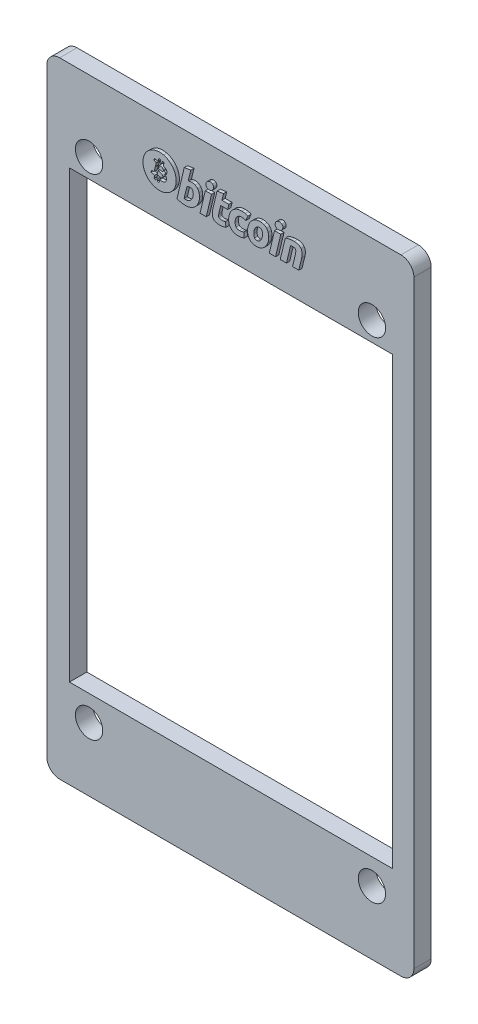
from build123d import *

# Parameters (mm, degrees)
ESQUISSE1_W             = 57
ESQUISSE1_H             = 97
BOSS_EXTRU_1_DEPTH      = 2.7
CONG_1_R                = 2
ESQUISSE2_W             = 50.132000889
ESQUISSE2_H             = 69.148527899
ENL_V_MAT_EXTRU_1_DEPTH = 4
ESQUISSE3_R             = 2.123955659
ENL_V_MAT_EXTRU_2_DEPTH = 4
BOSS_EXTRU_2_DEPTH      = 0.5


with BuildPart() as part:
    # Esquisse1 → Boss.-Extru.1 (new body)
    with BuildSketch(Plane.XY):
        with Locations((-2.5, -2.5)):
            Rectangle(ESQUISSE1_W, ESQUISSE1_H)
    extrude(amount=BOSS_EXTRU_1_DEPTH)

    # Congé1
    cong_1_edges = [part.edges().sort_by_distance(p)[0] for p in [
        (26, -51, 1.35),
        (-31, -51, 1.35),
        (-31, 46, 1.35),
        (26, 46, 1.35),
    ]]
    fillet(cong_1_edges, radius=CONG_1_R)

    # Esquisse2 → Enlèv. mat.-Extru.1 (cut)
    with BuildSketch(Plane.XY.offset(2.7)):
        with Locations((-2.412492696, -2.609286254)):
            Rectangle(ESQUISSE2_W, ESQUISSE2_H)
    extrude(amount=-ENL_V_MAT_EXTRU_1_DEPTH, mode=Mode.SUBTRACT)

    # Esquisse3 → Enlèv. mat.-Extru.2 (cut)
    with BuildSketch(Plane.XY.offset(2.7)):
        with Locations((-24.430072288, 34.959505651)):
            Circle(ESQUISSE3_R)
        with Locations((19.486527712, 34.959505651)):
            Circle(ESQUISSE3_R)
        with Locations((19.486527712, -41.138894349)):
            Circle(ESQUISSE3_R)
        with Locations((-24.430072288, -41.138894349)):
            Circle(ESQUISSE3_R)
    extrude(amount=-ENL_V_MAT_EXTRU_2_DEPTH, mode=Mode.SUBTRACT)

    # Esquisse4 → Boss.-Extru.2 (add)
    # profile 1 of 12: a face of its own
    with BuildSketch(Plane(origin=(-2.391362005, 35.741640935, 2.7), x_dir=(1, 0, 0), z_dir=(0, 0, 1))):
        with BuildLine():
            add(Edge.make_bspline(
                [(-9.965735834, 5.758576363), (-8.583076166, 5.413897855), (-7.741867028, 4.013418817), (-8.08646324, 2.630921455)],
                knots=[0, 0, 0, 0, 1, 1, 1, 1], degree=3))
            add(Edge.make_bspline(
                [(-8.08646324, 2.630921455), (-8.431141748, 1.248261787), (-9.831460766, 0.407054935), (-11.214038138, 0.751651147)],
                knots=[0, 0, 0, 0, 1, 1, 1, 1], degree=3))
            add(Edge.make_bspline(
                [(-11.214038138, 0.751651147), (-12.596133164, 1.096407379), (-13.437582332, 2.496726397), (-13.092663794, 3.879143749)],
                knots=[0, 0, 0, 0, 1, 1, 1, 1], degree=3))
            add(Edge.make_bspline(
                [(-13.092663794, 3.879143749), (-12.748229888, 5.261883427), (-11.347908584, 6.103252585), (-9.965735834, 5.758576363)],
                knots=[0, 0, 0, 0, 1, 1, 1, 1], degree=3))
        make_face()
        with BuildLine():
            add(Edge.make_bspline(
                [(-9.813332786, 3.206952307), (-9.628331378, 3.249693649), (-9.488976818, 3.371386573), (-9.4517996, 3.622757419)],
                knots=[0, 0, 0, 0, 1, 1, 1, 1], degree=3))
            add(Edge.make_bspline(
                [(-9.4517996, 3.622757419), (-9.400428608, 3.966144337), (-9.661880714, 4.150741123), (-10.019461406, 4.273885657)],
                knots=[0, 0, 0, 0, 1, 1, 1, 1], degree=3))
            Line((-10.019461406, 4.273885657), (-9.903412616, 4.739045509))
            Line((-9.903412616, 4.739045509), (-10.186556576, 4.809609757))
            Line((-10.186556576, 4.809609757), (-10.29945983, 4.356707437))
            add(Edge.make_bspline(
                [(-10.29945983, 4.356707437), (-10.373894276, 4.375256041), (-10.45034726, 4.392755371), (-10.526233316, 4.410094681)],
                knots=[0, 0, 0, 0, 1, 1, 1, 1], degree=3))
            Line((-10.526233316, 4.410094681), (-10.4126054, 4.865980231))
            Line((-10.4126054, 4.865980231), (-10.695507044, 4.936544479))
            Line((-10.695507044, 4.936544479), (-10.811555834, 4.471546933))
            add(Edge.make_bspline(
                [(-10.811555834, 4.471546933), (-10.873168106, 4.485578401), (-10.933651094, 4.499449849), (-10.992362432, 4.514045959)],
                knots=[0, 0, 0, 0, 1, 1, 1, 1], degree=3))
            Line((-10.992362432, 4.514045959), (-10.992040106, 4.515497569))
            Line((-10.992040106, 4.515497569), (-11.382523196, 4.612997755))
            Line((-11.382523196, 4.612997755), (-11.45784461, 4.310578243))
            add(Edge.make_bspline(
                [(-11.45784461, 4.310578243), (-11.247763496, 4.262432797), (-11.252280632, 4.259449567)],
                knots=[0, 0, 0, 1, 1, 1], degree=2))
            add(Edge.make_bspline(
                [(-11.252280632, 4.259449567), (-11.137523432, 4.230819703), (-11.11679627, 4.154933647), (-11.120264132, 4.094772985)],
                knots=[0, 0, 0, 0, 1, 1, 1, 1], degree=3))
            Line((-11.120264132, 4.094772985), (-11.252442938, 3.564855325))
            add(Edge.make_bspline(
                [(-11.252442938, 3.564855325), (-11.24445794, 3.562839073), (-11.23421666, 3.559853557), (-11.222926106, 3.555418717)],
                knots=[0, 0, 0, 0, 1, 1, 1, 1], degree=3))
            add(Edge.make_bspline(
                [(-11.222926106, 3.555418717), (-11.232442724, 3.557757295), (-11.242521698, 3.560338189), (-11.252845274, 3.562839073)],
                knots=[0, 0, 0, 0, 1, 1, 1, 1], degree=3))
            Line((-11.252845274, 3.562839073), (-11.438006702, 2.820501721))
            add(Edge.make_bspline(
                [(-11.438006702, 2.820501721), (-11.45203817, 2.785663081), (-11.487683768, 2.733485131), (-11.567764634, 2.753243029)],
                knots=[0, 0, 0, 0, 1, 1, 1, 1], degree=3))
            add(Edge.make_bspline(
                [(-11.567764634, 2.753243029), (-11.565021434, 2.749130515), (-11.773570928, 2.804614021)],
                knots=[0, 0, 0, 1, 1, 1], degree=2))
            Line((-11.773570928, 2.804614021), (-11.914214792, 2.480420359))
            Line((-11.914214792, 2.480420359), (-11.545668158, 2.388486583))
            add(Edge.make_bspline(
                [(-11.545668158, 2.388486583), (-11.477200172, 2.371307293), (-11.41002149, 2.353405627), (-11.343812072, 2.336468653)],
                knots=[0, 0, 0, 0, 1, 1, 1, 1], degree=3))
            Line((-11.343812072, 2.336468653), (-11.461070156, 1.865986993))
            Line((-11.461070156, 1.865986993), (-11.178248522, 1.795422745))
            Line((-11.178248522, 1.795422745), (-11.062199732, 2.260984933))
            add(Edge.make_bspline(
                [(-11.062199732, 2.260984933), (-10.984942076, 2.240017741), (-10.910022998, 2.220664465), (-10.83655553, 2.202355891)],
                knots=[0, 0, 0, 0, 1, 1, 1, 1], degree=3))
            Line((-10.83655553, 2.202355891), (-10.952199698, 1.739132281))
            Line((-10.952199698, 1.739132281), (-10.669055738, 1.668568033))
            Line((-10.669055738, 1.668568033), (-10.551877664, 2.138082715))
            add(Edge.make_bspline(
                [(-10.551877664, 2.138082715), (-10.069138472, 2.046711295), (-9.705993656, 2.083566187), (-9.553169984, 2.520178471)],
                knots=[0, 0, 0, 0, 1, 1, 1, 1], degree=3))
            add(Edge.make_bspline(
                [(-9.553169984, 2.520178471), (-9.43002545, 2.871790417), (-9.559301036, 3.074613481), (-9.813332786, 3.206952307)],
                knots=[0, 0, 0, 0, 1, 1, 1, 1], degree=3))
        make_face(mode=Mode.SUBTRACT)
    # profile 2 of 12: a face of its own
    with BuildSketch(Plane(origin=(-2.391362005, 35.741640935, 2.7), x_dir=(1, 0, 0), z_dir=(0, 0, 1))):
        with BuildLine():
            add(Edge.make_bspline(
                [(-10.602604004, 4.075659739), (-10.442846894, 4.035821617), (-9.928009976, 3.961467181), (-10.011154082, 3.627836911)],
                knots=[0, 0, 0, 0, 1, 1, 1, 1], degree=3))
            add(Edge.make_bspline(
                [(-10.011154082, 3.627836911), (-10.090992632, 3.308000365), (-10.583813084, 3.470500675), (-10.74357248, 3.510338797)],
                knots=[0, 0, 0, 0, 1, 1, 1, 1], degree=3))
            Line((-10.74357248, 3.510338797), (-10.602604004, 4.075659739))
        make_face()
    # profile 3 of 12: a face of its own
    with BuildSketch(Plane(origin=(-2.391362005, 35.741640935, 2.7), x_dir=(1, 0, 0), z_dir=(0, 0, 1))):
        with BuildLine():
            add(Edge.make_bspline(
                [(-10.81470137, 3.225096289), (-10.622766524, 3.177193159), (-10.007283884, 3.082273867), (-10.098735314, 2.715663475)],
                knots=[0, 0, 0, 0, 1, 1, 1, 1], degree=3))
            add(Edge.make_bspline(
                [(-10.098735314, 2.715663475), (-10.18623425, 2.364131539), (-10.778248814, 2.554050133), (-10.970265956, 2.601790957)],
                knots=[0, 0, 0, 0, 1, 1, 1, 1], degree=3))
            Line((-10.970265956, 2.601790957), (-10.81470137, 3.225096289))
        make_face()
    # profile 4 of 12: a face of its own
    with BuildSketch(Plane(origin=(-2.391362005, 35.741640935, 2.7), x_dir=(1, 0, 0), z_dir=(0, 0, 1))):
        with BuildLine():
            add(Edge.make_bspline(
                [(-5.888170202, 4.241474749), (-5.800993592, 4.263086593), (-5.7074459, 4.274377147), (-5.60752484, 4.274377147)],
                knots=[0, 0, 0, 0, 1, 1, 1, 1], degree=3))
            add(Edge.make_bspline(
                [(-5.60752484, 4.274377147), (-5.398170674, 4.274377147), (-5.217446372, 4.236877603), (-5.065429658, 4.163247829)],
                knots=[0, 0, 0, 0, 1, 1, 1, 1], degree=3))
            add(Edge.make_bspline(
                [(-5.065429658, 4.163247829), (-4.912768292, 4.088893393), (-4.786800548, 3.988732303), (-4.68575249, 3.862764559)],
                knots=[0, 0, 0, 0, 1, 1, 1, 1], degree=3))
            add(Edge.make_bspline(
                [(-4.68575249, 3.862764559), (-4.586156042, 3.736152163), (-4.511963912, 3.588167953), (-4.463978486, 3.418571899)],
                knots=[0, 0, 0, 0, 1, 1, 1, 1], degree=3))
            add(Edge.make_bspline(
                [(-4.463978486, 3.418571899), (-4.416399968, 3.248491213), (-4.39252727, 3.065670649), (-4.39252727, 2.870025625)],
                knots=[0, 0, 0, 0, 1, 1, 1, 1], degree=3))
            add(Edge.make_bspline(
                [(-4.39252727, 2.870025625), (-4.39252727, 2.569300039), (-4.44760844, 2.285349121), (-4.558897778, 2.017608229)],
                knots=[0, 0, 0, 0, 1, 1, 1, 1], degree=3))
            add(Edge.make_bspline(
                [(-4.558897778, 2.017608229), (-4.670107106, 1.749462715), (-4.820994536, 1.516882789), (-5.012929382, 1.318414555)],
                knots=[0, 0, 0, 0, 1, 1, 1, 1], degree=3))
            add(Edge.make_bspline(
                [(-5.012929382, 1.318414555), (-5.204704208, 1.120270933), (-5.431075358, 0.964141705), (-5.692202852, 0.848657557)],
                knots=[0, 0, 0, 0, 1, 1, 1, 1], degree=3))
            add(Edge.make_bspline(
                [(-5.692202852, 0.848657557), (-5.95292801, 0.733255705), (-6.236394296, 0.675513631), (-6.54075005, 0.675513631)],
                knots=[0, 0, 0, 0, 1, 1, 1, 1], degree=3))
            add(Edge.make_bspline(
                [(-6.54075005, 0.675513631), (-6.58010354, 0.675513631), (-6.649378484, 0.676642915), (-6.74703869, 0.678659167)],
                knots=[0, 0, 0, 0, 1, 1, 1, 1], degree=3))
            add(Edge.make_bspline(
                [(-6.74703869, 0.678659167), (-6.844781192, 0.680593123), (-6.957119804, 0.690674383), (-7.083007538, 0.707691367)],
                knots=[0, 0, 0, 0, 1, 1, 1, 1], degree=3))
            add(Edge.make_bspline(
                [(-7.083007538, 0.707691367), (-7.209537638, 0.725350717), (-7.34341037, 0.751479697), (-7.484778896, 0.786560653)],
                knots=[0, 0, 0, 0, 1, 1, 1, 1], degree=3))
            add(Edge.make_bspline(
                [(-7.484778896, 0.786560653), (-7.626069698, 0.820916947), (-7.76026247, 0.868980097), (-7.886634836, 0.930110023)],
                knots=[0, 0, 0, 0, 1, 1, 1, 1], degree=3))
            Line((-7.886634836, 0.930110023), (-6.756717614, 5.678246323))
            Line((-6.756717614, 5.678246323), (-5.744623118, 5.835100213))
            Line((-5.744623118, 5.835100213), (-6.149137676, 4.150183339))
            add(Edge.make_bspline(
                [(-6.149137676, 4.150183339), (-6.062525708, 4.189216789), (-5.975266802, 4.219458283), (-5.888170202, 4.241474749)],
                knots=[0, 0, 0, 0, 1, 1, 1, 1], degree=3))
        make_face()
        with BuildLine():
            add(Edge.make_bspline(
                [(-6.573732458, 1.478496277), (-6.542846312, 1.478496277), (-6.504297494, 1.478413981), (-6.456394364, 1.478413981)],
                knots=[0, 0, 0, 0, 1, 1, 1, 1], degree=3))
            add(Edge.make_bspline(
                [(-6.456394364, 1.478413981), (-6.303975314, 1.478413981), (-6.16034822, 1.515915811), (-6.0254285, 1.589463289)],
                knots=[0, 0, 0, 0, 1, 1, 1, 1], degree=3))
            add(Edge.make_bspline(
                [(-6.0254285, 1.589463289), (-5.890186454, 1.663173073), (-5.773330706, 1.762689511), (-5.67551048, 1.886641003)],
                knots=[0, 0, 0, 0, 1, 1, 1, 1], degree=3))
            add(Edge.make_bspline(
                [(-5.67551048, 1.886641003), (-5.577687968, 2.011237147), (-5.500348016, 2.151478675), (-5.443815236, 2.308252555)],
                knots=[0, 0, 0, 0, 1, 1, 1, 1], degree=3))
            add(Edge.make_bspline(
                [(-5.443815236, 2.308252555), (-5.387364752, 2.464864129), (-5.358897194, 2.628331417), (-5.358897194, 2.798332093)],
                knots=[0, 0, 0, 0, 1, 1, 1, 1], degree=3))
            add(Edge.make_bspline(
                [(-5.358897194, 2.798332093), (-5.358897194, 3.007443943), (-5.393735834, 3.170266579), (-5.463413114, 3.288169315)],
                knots=[0, 0, 0, 0, 1, 1, 1, 1], degree=3))
            add(Edge.make_bspline(
                [(-5.463413114, 3.288169315), (-5.533010384, 3.405507409), (-5.661719042, 3.464541073), (-5.848734416, 3.464541073)],
                knots=[0, 0, 0, 0, 1, 1, 1, 1], degree=3))
            add(Edge.make_bspline(
                [(-5.848734416, 3.464541073), (-5.910106658, 3.464541073), (-5.988975944, 3.452845897), (-6.086878466, 3.431958715)],
                knots=[0, 0, 0, 0, 1, 1, 1, 1], degree=3))
            add(Edge.make_bspline(
                [(-6.086878466, 3.431958715), (-6.18518561, 3.409782229), (-6.273089168, 3.363733045), (-6.351798434, 3.294460387)],
                knots=[0, 0, 0, 0, 1, 1, 1, 1], degree=3))
            Line((-6.351798434, 3.294460387), (-6.782604278, 1.505107603))
            add(Edge.make_bspline(
                [(-6.782604278, 1.505107603), (-6.756717614, 1.500430447), (-6.733651874, 1.496155627), (-6.714056282, 1.492043113)],
                knots=[0, 0, 0, 0, 1, 1, 1, 1], degree=3))
            add(Edge.make_bspline(
                [(-6.714056282, 1.492043113), (-6.694863026, 1.487528263), (-6.673653518, 1.484382727), (-6.65260403, 1.482286465)],
                knots=[0, 0, 0, 0, 1, 1, 1, 1], degree=3))
            add(Edge.make_bspline(
                [(-6.65260403, 1.482286465), (-6.630185228, 1.479785581), (-6.60462089, 1.478496277), (-6.573732458, 1.478496277)],
                knots=[0, 0, 0, 0, 1, 1, 1, 1], degree=3))
        make_face(mode=Mode.SUBTRACT)
    # profile 5 of 12: a face of its own
    with BuildSketch(Plane(origin=(-2.391362005, 35.741640935, 2.7), x_dir=(1, 0, 0), z_dir=(0, 0, 1))):
        Polygon((-2.519991518, 4.201563475), (-3.342974378, 0.766327267), (-4.309584332, 0.766327267), (-3.49321487, 4.201563475), align=None)
    # profile 6 of 12: a face of its own
    with BuildSketch(Plane(origin=(-2.391362005, 35.741640935, 2.7), x_dir=(1, 0, 0), z_dir=(0, 0, 1))):
        with BuildLine():
            add(Edge.make_bspline(
                [(-2.614748504, 4.672125145), (-2.695636328, 4.636804159), (-2.781281318, 4.620109501), (-2.872570442, 4.620109501)],
                knots=[0, 0, 0, 0, 1, 1, 1, 1], degree=3))
            add(Edge.make_bspline(
                [(-2.872570442, 4.620109501), (-3.007490162, 4.620109501), (-3.129747728, 4.660272235), (-3.238376162, 4.740755437)],
                knots=[0, 0, 0, 0, 1, 1, 1, 1], degree=3))
            add(Edge.make_bspline(
                [(-3.238376162, 4.740755437), (-3.347811554, 4.820754007), (-3.401925746, 4.943900827), (-3.401925746, 5.109866713)],
                knots=[0, 0, 0, 0, 1, 1, 1, 1], degree=3))
            add(Edge.make_bspline(
                [(-3.401925746, 5.109866713), (-3.401925746, 5.201158123), (-3.383457152, 5.286803113), (-3.34668227, 5.367608641)],
                knots=[0, 0, 0, 0, 1, 1, 1, 1], degree=3))
            add(Edge.make_bspline(
                [(-3.34668227, 5.367608641), (-3.309345032, 5.448254149), (-3.260554934, 5.517689113), (-3.199425008, 5.576720491)],
                knots=[0, 0, 0, 0, 1, 1, 1, 1], degree=3))
            add(Edge.make_bspline(
                [(-3.199425008, 5.576720491), (-3.138377378, 5.635269523), (-3.067650824, 5.682043369), (-2.987329928, 5.717204335)],
                knots=[0, 0, 0, 0, 1, 1, 1, 1], degree=3))
            add(Edge.make_bspline(
                [(-2.987329928, 5.717204335), (-2.906522114, 5.751962965), (-2.820474788, 5.769382285), (-2.728943348, 5.769382285)],
                knots=[0, 0, 0, 0, 1, 1, 1, 1], degree=3))
            add(Edge.make_bspline(
                [(-2.728943348, 5.769382285), (-2.594103638, 5.769382285), (-2.472410714, 5.729221837), (-2.363459954, 5.648736349)],
                knots=[0, 0, 0, 0, 1, 1, 1, 1], degree=3))
            add(Edge.make_bspline(
                [(-2.363459954, 5.648736349), (-2.25491153, 5.567850811), (-2.200314992, 5.444706277), (-2.200314992, 5.279625073)],
                knots=[0, 0, 0, 0, 1, 1, 1, 1], degree=3))
            add(Edge.make_bspline(
                [(-2.200314992, 5.279625073), (-2.200314992, 5.188011337), (-2.2187813, 5.102044021), (-2.255878508, 5.021400799)],
                knots=[0, 0, 0, 0, 1, 1, 1, 1], degree=3))
            add(Edge.make_bspline(
                [(-2.255878508, 5.021400799), (-2.2927334, 4.940755291), (-2.341523498, 4.871320327), (-2.402653424, 4.812286663)],
                knots=[0, 0, 0, 0, 1, 1, 1, 1], degree=3))
            add(Edge.make_bspline(
                [(-2.402653424, 4.812286663), (-2.463216422, 4.753657621), (-2.534587628, 4.707046081), (-2.614748504, 4.672125145)],
                knots=[0, 0, 0, 0, 1, 1, 1, 1], degree=3))
        make_face()
    # profile 7 of 12: a face of its own
    with BuildSketch(Plane(origin=(-2.391362005, 35.741640935, 2.7), x_dir=(1, 0, 0), z_dir=(0, 0, 1))):
        with BuildLine():
            add(Edge.make_bspline(
                [(-2.404434218, 1.720099045), (-2.395564538, 1.920663541), (-2.365323044, 2.131711633), (-2.313065084, 2.353727953)],
                knots=[0, 0, 0, 0, 1, 1, 1, 1], degree=3))
            Line((-2.313065084, 2.353727953), (-1.672822778, 5.057432731))
            Line((-1.672822778, 5.057432731), (-0.660245936, 5.214286621))
            Line((-0.660245936, 5.214286621), (-0.908873582, 4.201707493))
            Line((-0.908873582, 4.201707493), (0.175399078, 4.201707493))
            Line((0.175399078, 4.201707493), (-0.020408252, 3.405095929))
            Line((-0.020408252, 3.405095929), (-1.098227534, 3.405095929))
            Line((-1.098227534, 3.405095929), (-1.385323988, 2.203405165))
            add(Edge.make_bspline(
                [(-1.385323988, 2.203405165), (-1.411775294, 2.103406381), (-1.426696016, 2.009856403), (-1.43096855, 1.922922109)],
                knots=[0, 0, 0, 0, 1, 1, 1, 1], degree=3))
            add(Edge.make_bspline(
                [(-1.43096855, 1.922922109), (-1.435728002, 1.835503183), (-1.424679764, 1.760504095), (-1.398550784, 1.697357917)],
                knots=[0, 0, 0, 0, 1, 1, 1, 1], degree=3))
            add(Edge.make_bspline(
                [(-1.398550784, 1.697357917), (-1.372501814, 1.634051719), (-1.325807978, 1.585181611), (-1.25806694, 1.550907613)],
                knots=[0, 0, 0, 0, 1, 1, 1, 1], degree=3))
            add(Edge.make_bspline(
                [(-1.25806694, 1.550907613), (-1.190648228, 1.515744361), (-1.09411502, 1.498085011), (-0.967582634, 1.498085011)],
                knots=[0, 0, 0, 0, 1, 1, 1, 1], degree=3))
            add(Edge.make_bspline(
                [(-0.967582634, 1.498085011), (-0.86330903, 1.498085011), (-0.76161632, 1.508003965), (-0.663389186, 1.527681853)],
                knots=[0, 0, 0, 0, 1, 1, 1, 1], degree=3))
            add(Edge.make_bspline(
                [(-0.663389186, 1.527681853), (-0.56572898, 1.546955119), (-0.46685948, 1.573891057), (-0.36669839, 1.609212043)],
                knots=[0, 0, 0, 0, 1, 1, 1, 1], degree=3))
            Line((-0.36669839, 1.609212043), (-0.294520226, 0.864376093))
            add(Edge.make_bspline(
                [(-0.294520226, 0.864376093), (-0.42500282, 0.816472963), (-0.566455928, 0.775263241), (-0.719034998, 0.740584621)],
                knots=[0, 0, 0, 0, 1, 1, 1, 1], degree=3))
            add(Edge.make_bspline(
                [(-0.719034998, 0.740584621), (-0.871616354, 0.705423655), (-1.052420666, 0.688568977), (-1.261212476, 0.688568977)],
                knots=[0, 0, 0, 0, 1, 1, 1, 1], degree=3))
            add(Edge.make_bspline(
                [(-1.261212476, 0.688568977), (-1.56161345, 0.688568977), (-1.794435692, 0.733166551), (-1.960241558, 0.821874781)],
                knots=[0, 0, 0, 0, 1, 1, 1, 1], degree=3))
            add(Edge.make_bspline(
                [(-1.960241558, 0.821874781), (-2.125967414, 0.911229949), (-2.242983182, 1.033487515), (-2.313065084, 1.188165133)],
                knots=[0, 0, 0, 0, 1, 1, 1, 1], degree=3))
            add(Edge.make_bspline(
                [(-2.313065084, 1.188165133), (-2.382257732, 1.342198099), (-2.413143878, 1.519859161), (-2.404434218, 1.720099045)],
                knots=[0, 0, 0, 0, 1, 1, 1, 1], degree=3))
        make_face()
    # profile 8 of 12: a face of its own
    with BuildSketch(Plane(origin=(-2.391362005, 35.741640935, 2.7), x_dir=(1, 0, 0), z_dir=(0, 0, 1))):
        with BuildLine():
            add(Edge.make_bspline(
                [(0.215125186, 1.576455949), (0.160768678, 1.754921683), (0.132945772, 1.942583995), (0.132945772, 2.137986703)],
                knots=[0, 0, 0, 0, 1, 1, 1, 1], degree=3))
            add(Edge.make_bspline(
                [(0.132945772, 2.137986703), (0.132945772, 2.433952837), (0.180848902, 2.712904273), (0.276495142, 2.974194073)],
                knots=[0, 0, 0, 0, 1, 1, 1, 1], degree=3))
            add(Edge.make_bspline(
                [(0.276495142, 2.974194073), (0.372059086, 3.235646179), (0.50971972, 3.464273611), (0.68826775, 3.660403267)],
                knots=[0, 0, 0, 0, 1, 1, 1, 1], degree=3))
            add(Edge.make_bspline(
                [(0.68826775, 3.660403267), (0.866251138, 3.855643669), (1.08302566, 4.010321287), (1.338346714, 4.123869193)],
                knots=[0, 0, 0, 0, 1, 1, 1, 1], degree=3))
            add(Edge.make_bspline(
                [(1.338346714, 4.123869193), (1.592298454, 4.236772447), (1.876814014, 4.293707563), (2.190201754, 4.293707563)],
                knots=[0, 0, 0, 0, 1, 1, 1, 1], degree=3))
            add(Edge.make_bspline(
                [(2.190201754, 4.293707563), (2.386409134, 4.293707563), (2.561731618, 4.275158959), (2.715924604, 4.237981741)],
                knots=[0, 0, 0, 0, 1, 1, 1, 1], degree=3))
            add(Edge.make_bspline(
                [(2.715924604, 4.237981741), (2.870844538, 4.200482197), (3.01084375, 4.152014425), (3.137538442, 4.091209111)],
                knots=[0, 0, 0, 0, 1, 1, 1, 1], degree=3))
            Line((3.137538442, 4.091209111), (2.804232784, 3.333144079))
            add(Edge.make_bspline(
                [(2.804232784, 3.333144079), (2.717136184, 3.368467351), (2.626731742, 3.399595813), (2.53318405, 3.427823341)],
                knots=[0, 0, 0, 0, 1, 1, 1, 1], degree=3))
            add(Edge.make_bspline(
                [(2.53318405, 3.427823341), (2.439716368, 3.456613225), (2.325441514, 3.470482387), (2.190441784, 3.470482387)],
                knots=[0, 0, 0, 0, 1, 1, 1, 1], degree=3))
            add(Edge.make_bspline(
                [(2.190441784, 3.470482387), (1.867702018, 3.470482387), (1.612701004, 3.359273059), (1.422864706, 3.137661361)],
                knots=[0, 0, 0, 0, 1, 1, 1, 1], degree=3))
            add(Edge.make_bspline(
                [(1.422864706, 3.137661361), (1.233590764, 2.915727337), (1.138429156, 2.617018003), (1.138429156, 2.242502623)],
                knots=[0, 0, 0, 0, 1, 1, 1, 1], degree=3))
            add(Edge.make_bspline(
                [(1.138429156, 2.242502623), (1.138429156, 2.020406293), (1.186412296, 1.840971295), (1.282540882, 1.703632987)],
                knots=[0, 0, 0, 0, 1, 1, 1, 1], degree=3))
            add(Edge.make_bspline(
                [(1.282540882, 1.703632987), (1.378104826, 1.566294679), (1.55487892, 1.497906703), (1.811331544, 1.497906703)],
                knots=[0, 0, 0, 0, 1, 1, 1, 1], degree=3))
            add(Edge.make_bspline(
                [(1.811331544, 1.497906703), (1.93794394, 1.497906703), (2.060121496, 1.511213509), (2.177217274, 1.536937867)],
                knots=[0, 0, 0, 0, 1, 1, 1, 1], degree=3))
            add(Edge.make_bspline(
                [(2.177217274, 1.536937867), (2.29512001, 1.563066847), (2.399233594, 1.595971531), (2.490925054, 1.634842675)],
                knots=[0, 0, 0, 0, 1, 1, 1, 1], degree=3))
            Line((2.490925054, 1.634842675), (2.563183228, 0.857746693))
            add(Edge.make_bspline(
                [(2.563183228, 0.857746693), (2.440925662, 0.810328195), (2.306005942, 0.767504557), (2.158184038, 0.730005013)],
                knots=[0, 0, 0, 0, 1, 1, 1, 1], degree=3))
            add(Edge.make_bspline(
                [(2.158184038, 0.730005013), (2.009877502, 0.693794773), (1.83350803, 0.674923843), (1.62891103, 0.674923843)],
                knots=[0, 0, 0, 0, 1, 1, 1, 1], degree=3))
            add(Edge.make_bspline(
                [(1.62891103, 0.674923843), (1.35891157, 0.674923843), (1.130201842, 0.714521935), (0.943268764, 0.792261937)],
                knots=[0, 0, 0, 0, 1, 1, 1, 1], degree=3))
            add(Edge.make_bspline(
                [(0.943268764, 0.792261937), (0.756171094, 0.871295815), (0.601575772, 0.976294081), (0.479720542, 1.109117539)],
                knots=[0, 0, 0, 0, 1, 1, 1, 1], degree=3))
            add(Edge.make_bspline(
                [(0.479720542, 1.109117539), (0.35722066, 1.242343333), (0.269397112, 1.397987929), (0.215125186, 1.576455949)],
                knots=[0, 0, 0, 0, 1, 1, 1, 1], degree=3))
        make_face()
    # profile 9 of 12: a face of its own
    with BuildSketch(Plane(origin=(-2.391362005, 35.741640935, 2.7), x_dir=(1, 0, 0), z_dir=(0, 0, 1))):
        with BuildLine():
            add(Edge.make_bspline(
                [(5.266590826, 0.874601371), (5.025218944, 0.741780199), (4.745058214, 0.675246169), (4.42731793, 0.675246169)],
                knots=[0, 0, 0, 0, 1, 1, 1, 1], degree=3))
            add(Edge.make_bspline(
                [(4.42731793, 0.675246169), (4.19651194, 0.675246169), (3.996027454, 0.710409421), (3.826109074, 0.780004405)],
                knots=[0, 0, 0, 0, 1, 1, 1, 1], degree=3))
            add(Edge.make_bspline(
                [(3.826109074, 0.780004405), (3.65651302, 0.849521665), (3.516271492, 0.947261881), (3.405222184, 1.073956573)],
                knots=[0, 0, 0, 0, 1, 1, 1, 1], degree=3))
            add(Edge.make_bspline(
                [(3.405222184, 1.073956573), (3.293852836, 1.199842021), (3.210706444, 1.349117821), (3.153691318, 1.521132463)],
                knots=[0, 0, 0, 0, 1, 1, 1, 1], degree=3))
            add(Edge.make_bspline(
                [(3.153691318, 1.521132463), (3.096673906, 1.693067095), (3.069255622, 1.883550331), (3.069255622, 2.092099825)],
                knots=[0, 0, 0, 0, 1, 1, 1, 1], degree=3))
            add(Edge.make_bspline(
                [(3.069255622, 2.092099825), (3.069255622, 2.353711951), (3.111190006, 2.615324077), (3.196110334, 2.876371561)],
                knots=[0, 0, 0, 0, 1, 1, 1, 1], degree=3))
            add(Edge.make_bspline(
                [(3.196110334, 2.876371561), (3.280788346, 3.137823667), (3.406189162, 3.372662161), (3.571997314, 3.581451685)],
                knots=[0, 0, 0, 0, 1, 1, 1, 1], degree=3))
            add(Edge.make_bspline(
                [(3.571997314, 3.581451685), (3.736673896, 3.790563535), (3.939979306, 3.961531189), (4.179010324, 4.094836993)],
                knots=[0, 0, 0, 0, 1, 1, 1, 1], degree=3))
            add(Edge.make_bspline(
                [(4.179010324, 4.094836993), (4.417963618, 4.227255829), (4.692800254, 4.293869869), (5.001510838, 4.293869869)],
                knots=[0, 0, 0, 0, 1, 1, 1, 1], degree=3))
            add(Edge.make_bspline(
                [(5.001510838, 4.293869869), (5.227961998, 4.293869869), (5.427314914, 4.258626607), (5.599734178, 4.189029337)],
                knots=[0, 0, 0, 0, 1, 1, 1, 1], degree=3))
            add(Edge.make_bspline(
                [(5.599734178, 4.189029337), (5.771266474, 4.119594373), (5.912557276, 4.021127209), (6.02424895, 3.895159465)],
                knots=[0, 0, 0, 0, 1, 1, 1, 1], degree=3))
            add(Edge.make_bspline(
                [(6.02424895, 3.895159465), (6.134813626, 3.768547069), (6.21876469, 3.619918207), (6.275135164, 3.447661249)],
                knots=[0, 0, 0, 0, 1, 1, 1, 1], degree=3))
            add(Edge.make_bspline(
                [(6.275135164, 3.447661249), (6.33199027, 3.276048943), (6.360055492, 3.085161085), (6.360055492, 2.876371561)],
                knots=[0, 0, 0, 0, 1, 1, 1, 1], degree=3))
            add(Edge.make_bspline(
                [(6.360055492, 2.876371561), (6.360055492, 2.615566393), (6.318603454, 2.353871971), (6.236346316, 2.092259845)],
                knots=[0, 0, 0, 0, 1, 1, 1, 1], degree=3))
            add(Edge.make_bspline(
                [(6.236346316, 2.092259845), (6.154089178, 1.831777003), (6.031829326, 1.596293857), (5.870540596, 1.387099711)],
                knots=[0, 0, 0, 0, 1, 1, 1, 1], degree=3))
            add(Edge.make_bspline(
                [(5.870540596, 1.387099711), (5.709571906, 1.178230177), (5.508362758, 1.007342533), (5.266590826, 0.874601371)],
                knots=[0, 0, 0, 0, 1, 1, 1, 1], degree=3))
        make_face()
        with BuildLine():
            add(Edge.make_bspline(
                [(5.289251944, 3.287821843), (5.219734684, 3.409354747), (5.093202298, 3.470482387), (4.910299438, 3.470482387)],
                knots=[0, 0, 0, 0, 1, 1, 1, 1], degree=3))
            add(Edge.make_bspline(
                [(4.910299438, 3.470482387), (4.76707468, 3.470482387), (4.640299978, 3.428870329), (4.53191386, 3.346693201)],
                knots=[0, 0, 0, 0, 1, 1, 1, 1], degree=3))
            add(Edge.make_bspline(
                [(4.53191386, 3.346693201), (4.4229631, 3.263549095), (4.33159168, 3.158950879), (4.257881896, 3.033065431)],
                knots=[0, 0, 0, 0, 1, 1, 1, 1], degree=3))
            add(Edge.make_bspline(
                [(4.257881896, 3.033065431), (4.183365154, 2.906370739), (4.12828627, 2.768227759), (4.090946746, 2.618227297)],
                knots=[0, 0, 0, 0, 1, 1, 1, 1], degree=3))
            add(Edge.make_bspline(
                [(4.090946746, 2.618227297), (4.053931834, 2.467824499), (4.035625546, 2.325566719), (4.035625546, 2.190486979)],
                knots=[0, 0, 0, 0, 1, 1, 1, 1], degree=3))
            add(Edge.make_bspline(
                [(4.035625546, 2.190486979), (4.035625546, 1.972583173), (4.070946532, 1.802744803), (4.13989915, 1.680567247)],
                knots=[0, 0, 0, 0, 1, 1, 1, 1], degree=3))
            add(Edge.make_bspline(
                [(4.13989915, 1.680567247), (4.209898756, 1.559116639), (4.33602652, 1.497986713), (4.51884937, 1.497986713)],
                knots=[0, 0, 0, 0, 1, 1, 1, 1], degree=3))
            add(Edge.make_bspline(
                [(4.51884937, 1.497986713), (4.66263877, 1.497986713), (4.788686524, 1.539278731), (4.89779959, 1.622260531)],
                knots=[0, 0, 0, 0, 1, 1, 1, 1], degree=3))
            add(Edge.make_bspline(
                [(4.89779959, 1.622260531), (5.006025688, 1.704762271), (5.097557128, 1.809358201), (5.171751544, 1.935728281)],
                knots=[0, 0, 0, 0, 1, 1, 1, 1], degree=3))
            add(Edge.make_bspline(
                [(5.171751544, 1.935728281), (5.245783654, 2.061616015), (5.301589486, 2.200163617), (5.338846714, 2.350486405)],
                knots=[0, 0, 0, 0, 1, 1, 1, 1], degree=3))
            add(Edge.make_bspline(
                [(5.338846714, 2.350486405), (5.375461576, 2.500404571), (5.394007894, 2.643389299), (5.394007894, 2.778226723)],
                knots=[0, 0, 0, 0, 1, 1, 1, 1], degree=3))
            add(Edge.make_bspline(
                [(5.394007894, 2.778226723), (5.394007894, 2.995645897), (5.359009234, 3.165806593), (5.289251944, 3.287821843)],
                knots=[0, 0, 0, 0, 1, 1, 1, 1], degree=3))
        make_face(mode=Mode.SUBTRACT)
    # profile 10 of 12: a face of its own
    with BuildSketch(Plane(origin=(-2.391362005, 35.741640935, 2.7), x_dir=(1, 0, 0), z_dir=(0, 0, 1))):
        Polygon((8.236123114, 4.201563475), (7.413464866, 0.766327267), (6.446127964, 0.766327267), (7.262417416, 4.201563475), align=None)
    # profile 11 of 12: a face of its own
    with BuildSketch(Plane(origin=(-2.391362005, 35.741640935, 2.7), x_dir=(1, 0, 0), z_dir=(0, 0, 1))):
        with BuildLine():
            add(Edge.make_bspline(
                [(8.141688454, 4.672125145), (8.06064061, 4.636804159), (7.97499562, 4.620109501), (7.883141854, 4.620109501)],
                knots=[0, 0, 0, 0, 1, 1, 1, 1], degree=3))
            add(Edge.make_bspline(
                [(7.883141854, 4.620109501), (7.748302144, 4.620109501), (7.626044578, 4.660272235), (7.51773847, 4.740755437)],
                knots=[0, 0, 0, 0, 1, 1, 1, 1], degree=3))
            add(Edge.make_bspline(
                [(7.51773847, 4.740755437), (7.408705414, 4.820754007), (7.354108876, 4.943900827), (7.354108876, 5.109866713)],
                knots=[0, 0, 0, 0, 1, 1, 1, 1], degree=3))
            add(Edge.make_bspline(
                [(7.354108876, 5.109866713), (7.354108876, 5.201158123), (7.372899796, 5.286803113), (7.409754688, 5.367608641)],
                knots=[0, 0, 0, 0, 1, 1, 1, 1], degree=3))
            add(Edge.make_bspline(
                [(7.409754688, 5.367608641), (7.44660958, 5.448254149), (7.495641994, 5.517689113), (7.556769634, 5.576720491)],
                knots=[0, 0, 0, 0, 1, 1, 1, 1], degree=3))
            add(Edge.make_bspline(
                [(7.556769634, 5.576720491), (7.617577234, 5.635269523), (7.68894844, 5.682043369), (7.769109316, 5.717204335)],
                knots=[0, 0, 0, 0, 1, 1, 1, 1], degree=3))
            add(Edge.make_bspline(
                [(7.769109316, 5.717204335), (7.849432498, 5.751962965), (7.935399814, 5.769382285), (8.026608928, 5.769382285)],
                knots=[0, 0, 0, 0, 1, 1, 1, 1], degree=3))
            add(Edge.make_bspline(
                [(8.026608928, 5.769382285), (8.161850974, 5.769382285), (8.283946234, 5.729221837), (8.392656964, 5.648736349)],
                knots=[0, 0, 0, 0, 1, 1, 1, 1], degree=3))
            add(Edge.make_bspline(
                [(8.392656964, 5.648736349), (8.501445418, 5.567850811), (8.556284272, 5.444706277), (8.556284272, 5.279625073)],
                knots=[0, 0, 0, 0, 1, 1, 1, 1], degree=3))
            add(Edge.make_bspline(
                [(8.556284272, 5.279625073), (8.556284272, 5.188011337), (8.53676869, 5.102044021), (8.500236124, 5.021400799)],
                knots=[0, 0, 0, 0, 1, 1, 1, 1], degree=3))
            add(Edge.make_bspline(
                [(8.500236124, 5.021400799), (8.463703558, 4.940755291), (8.414591134, 4.871320327), (8.35378582, 4.812286663)],
                knots=[0, 0, 0, 0, 1, 1, 1, 1], degree=3))
            add(Edge.make_bspline(
                [(8.35378582, 4.812286663), (8.292495874, 4.753657621), (8.221931626, 4.707046081), (8.141688454, 4.672125145)],
                knots=[0, 0, 0, 0, 1, 1, 1, 1], degree=3))
        make_face()
    # profile 12 of 12: a face of its own
    with BuildSketch(Plane(origin=(-2.391362005, 35.741640935, 2.7), x_dir=(1, 0, 0), z_dir=(0, 0, 1))):
        with BuildLine():
            add(Edge.make_bspline(
                [(10.134394654, 3.464467921), (10.00842691, 3.464467921), (9.880120588, 3.450918799), (9.749233372, 3.424789819)],
                knots=[0, 0, 0, 0, 1, 1, 1, 1], degree=3))
            Line((9.749233372, 3.424789819), (9.11568676, 0.766891909))
            Line((9.11568676, 0.766891909), (8.142221092, 0.766891909))
            Line((8.142221092, 0.766891909), (8.93286391, 4.045354237))
            add(Edge.make_bspline(
                [(8.93286391, 4.045354237), (9.006171358, 4.066803775), (9.08818618, 4.092610429), (9.177219022, 4.120675651)],
                knots=[0, 0, 0, 0, 1, 1, 1, 1], degree=3))
            add(Edge.make_bspline(
                [(9.177219022, 4.120675651), (9.26673421, 4.148740873), (9.36665527, 4.174787557), (9.478266934, 4.198337929)],
                knots=[0, 0, 0, 0, 1, 1, 1, 1], degree=3))
            add(Edge.make_bspline(
                [(9.478266934, 4.198337929), (9.588669304, 4.222690687), (9.713265448, 4.242368575), (9.85028143, 4.257611623)],
                knots=[0, 0, 0, 0, 1, 1, 1, 1], degree=3))
            add(Edge.make_bspline(
                [(9.85028143, 4.257611623), (9.987137392, 4.273174711), (10.14342664, 4.280755087), (10.316732872, 4.280755087)],
                knots=[0, 0, 0, 0, 1, 1, 1, 1], degree=3))
            add(Edge.make_bspline(
                [(10.316732872, 4.280755087), (10.826570308, 4.280755087), (11.178102244, 4.132288531), (11.372053342, 3.836240101)],
                knots=[0, 0, 0, 0, 1, 1, 1, 1], degree=3))
            add(Edge.make_bspline(
                [(11.372053342, 3.836240101), (11.56592443, 3.540193957), (11.59947148, 3.135112471), (11.473746052, 2.621484847)],
                knots=[0, 0, 0, 0, 1, 1, 1, 1], degree=3))
            Line((11.473746052, 2.621484847), (11.02898875, 0.766649593))
            Line((11.02898875, 0.766649593), (10.056007714, 0.766649593))
            Line((10.056007714, 0.766649593), (10.486973578, 2.582533693))
            add(Edge.make_bspline(
                [(10.486973578, 2.582533693), (10.513264864, 2.695839283), (10.53390973, 2.805516991), (10.549232788, 2.912533795)],
                knots=[0, 0, 0, 0, 1, 1, 1, 1], degree=3))
            add(Edge.make_bspline(
                [(10.549232788, 2.912533795), (10.564555846, 3.018741355), (10.563748888, 3.112371343), (10.545684916, 3.193259167)],
                knots=[0, 0, 0, 0, 1, 1, 1, 1], degree=3))
            add(Edge.make_bspline(
                [(10.545684916, 3.193259167), (10.528507912, 3.273257737), (10.488022852, 3.338742493), (10.425281296, 3.389466547)],
                knots=[0, 0, 0, 0, 1, 1, 1, 1], degree=3))
            add(Edge.make_bspline(
                [(10.425281296, 3.389466547), (10.361490466, 3.439385929), (10.265119564, 3.464467921), (10.134394654, 3.464467921)],
                knots=[0, 0, 0, 0, 1, 1, 1, 1], degree=3))
        make_face()
    extrude(amount=BOSS_EXTRU_2_DEPTH)


solid = part.part
